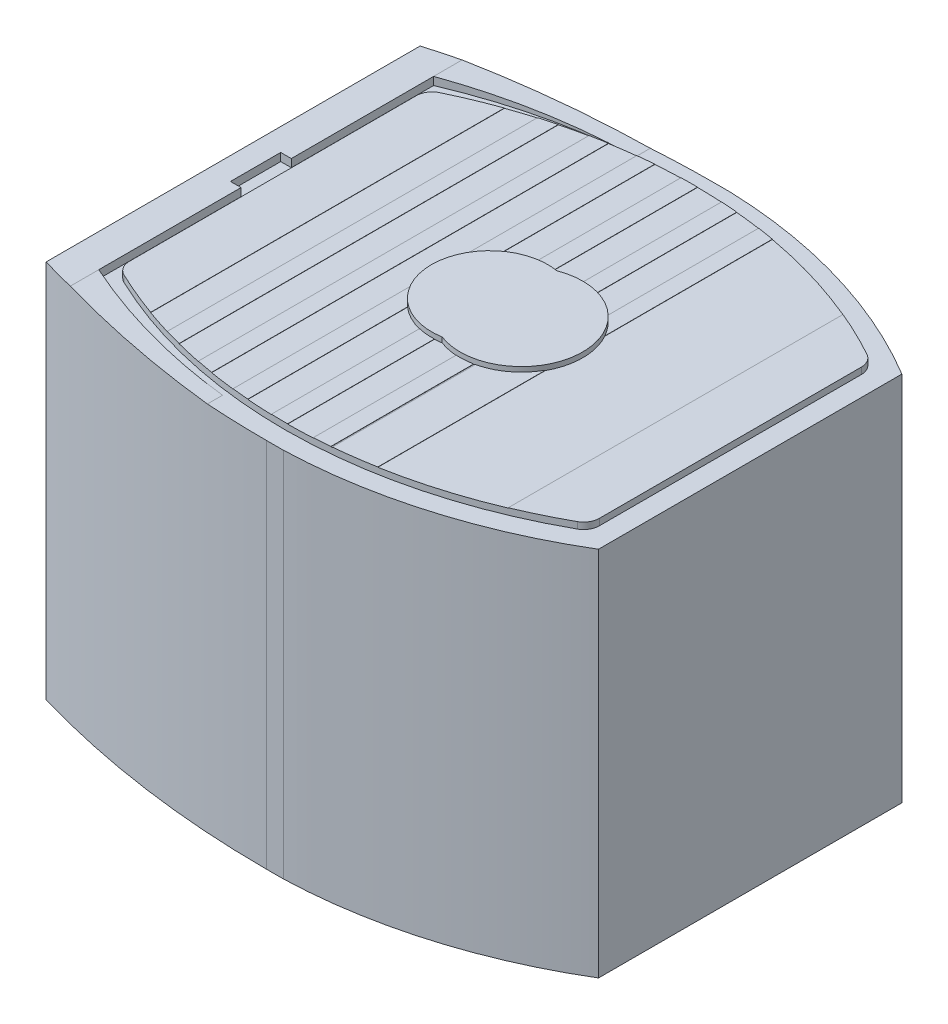
from build123d import *

# Parameters (mm, degrees)
BOSS_EXTRUDE1_DEPTH      = 40
CUT_EXTRUDE1_DEPTH       = 40
CUT_EXTRUDE1_DEPTH_BACK  = 40
CUT_EXTRUDE2_DEPTH       = 40
BOSS_EXTRUDE2_DEPTH      = 0.6223
CUT_EXTRUDE3_DEPTH       = 0.0254
CUT_EXTRUDE4_DEPTH       = 2.032
BOSS_EXTRUDE3_DEPTH      = 0.464
BOSS_EXTRUDE3_DEPTH_BACK = 0.464


with BuildPart() as part:
    # Sketch1 → Boss-Extrude1 (new body)
    with BuildSketch(Plane(origin=(0, -30.021892368, 0), x_dir=(-1, 0, 0), z_dir=(0, -1, 0))):
        with BuildLine():
            Line((-83.1596, 21.651358884), (-84.762120236, 21.651358884))
            ThreePointArc((-84.762120236, 21.651358884), (-96.885117924, 19.694671586), (-108.1278, 14.755258884))
            Line((-108.1278, 14.755258884), (-108.1278, -14.378541116))
            ThreePointArc((-108.1278, -14.378541116), (-96.885117924, -19.317953818), (-84.762120236, -21.274641116))
            Line((-84.762120236, -21.274641116), (-83.1596, -21.274641116))
            ThreePointArc((-83.1596, -21.274641116), (-70.690971885, -20.397039146), (-58.4708, -17.769441116))
            Line((-58.4708, -17.769441116), (-58.4708, 18.146158884))
            ThreePointArc((-58.4708, 18.146158884), (-70.690971885, 20.773756915), (-83.1596, 21.651358884))
        make_face()
    extrude(amount=-BOSS_EXTRUDE1_DEPTH)

    # Sketch2 → Cut-Extrude1 (cut, two sides: drawn at the far end of the back side and taken through both)
    with BuildSketch(Plane.XY.offset(-CUT_EXTRUDE1_DEPTH_BACK)):
        Polygon((54.820843696, 15.118469848), (54.820843696, 6.401707632), (61.6458, 6.401707632), (77.2668, 5.639707632), (110.448229866, 5.639707632), (110.448229866, 15.118469848), align=None)
    extrude(amount=CUT_EXTRUDE1_DEPTH + CUT_EXTRUDE1_DEPTH_BACK, mode=Mode.SUBTRACT)

    # Sketch3 → Cut-Extrude2 (cut)
    with BuildSketch(Plane(origin=(0, 5.639707632, 0), x_dir=(1, 0, 0), z_dir=(0, 1, 0))):
        with BuildLine():
            Line((60.6298, -2.224641116), (61.6458, -2.224641116))
            Line((61.6458, -2.224641116), (61.6458, -15.889841116))
            ThreePointArc((61.6458, -15.889841116), (69.299882493, -18.411140892), (77.2668, -19.623641116))
            Line((77.2668, -19.623641116), (77.2668, -24.484863345))
            Line((77.2668, -24.484863345), (116.145527093, -24.484863345))
            Line((116.145527093, -24.484863345), (116.145527093, 24.141945465))
            Line((116.145527093, 24.141945465), (77.2668, 24.141945465))
            Line((77.2668, 24.141945465), (77.2668, 20.000358884))
            ThreePointArc((77.2668, 20.000358884), (69.299882493, 18.78785866), (61.6458, 16.266558884))
            Line((61.6458, 16.266558884), (61.6458, 2.601358884))
            Line((61.6458, 2.601358884), (60.6298, 2.601358884))
            Line((60.6298, 2.601358884), (60.6298, -2.224641116))
        make_face()
    extrude(amount=CUT_EXTRUDE2_DEPTH, mode=Mode.SUBTRACT)

    # Sketch4 → Boss-Extrude2 (add)
    with BuildSketch(Plane(origin=(0, 5.639707632, 0), x_dir=(1, 0, 0), z_dir=(0, 1, 0))):
        with BuildLine():
            Line((62.2808, 13.97160372), (62.2808, -13.595028424))
            ThreePointArc((62.2808, -13.595028424), (62.515232291, -14.407180579), (63.146405148, -14.969470936))
            ThreePointArc((63.146405148, -14.969470936), (84.443626018, -19.477271857), (105.437261458, -13.718873038))
            ThreePointArc((105.437261458, -13.718873038), (106.011810141, -13.159417141), (106.2228, -12.385737382))
            Line((106.2228, -12.385737382), (106.2228, 12.76231749))
            ThreePointArc((106.2228, 12.76231749), (106.011758355, 13.536085129), (105.437082995, 14.095551986))
            ThreePointArc((105.437082995, 14.095551986), (84.443582525, 19.852401671), (63.146588971, 15.346134273))
            ThreePointArc((63.146588971, 15.346134273), (62.515286602, 14.783842106), (62.2808, 13.97160372))
        make_face()
    extrude(amount=BOSS_EXTRUDE2_DEPTH)

    # Sketch5 → Cut-Extrude3 (cut)
    with BuildSketch(Plane(origin=(0, 6.236607632, 0), x_dir=(1, 0, 0), z_dir=(0, 1, 0))):
        Polygon((60.8798, -1.974641116), (61.8958, -1.974641116), (61.8958, -15.724128062), (70.725222183, -18.261597014), (77.5168, -19.389388124), (77.5168, -26.279232644), (112.598613265, -26.279232644), (112.598613265, 26.642797699), (77.5168, 26.642797699), (77.5168, 19.766105893), (68.79799987, 18.208824767), (61.8958, 16.100845831), (61.8958, 2.351358884), (60.8798, 2.351358884), align=None)
        with BuildLine():
            Line((106.2228, -12.385737382), (106.2228, 12.76231749))
            ThreePointArc((106.2228, 12.76231749), (106.011758355, 13.536085129), (105.437082995, 14.095551986))
            ThreePointArc((105.437082995, 14.095551986), (103.230284294, 15.241015763), (100.965, 16.26597178))
            Line((100.965, 16.26597178), (100.965, -15.890015871))
            ThreePointArc((100.965, -15.890015871), (103.230393421, -14.864721653), (105.437261458, -13.718873038))
            ThreePointArc((105.437261458, -13.718873038), (106.011810141, -13.159417141), (106.2228, -12.385737382))
        make_face(mode=Mode.SUBTRACT)
        with BuildLine():
            Line((87.4776, -5.556736292), (87.4776, -19.287368321))
            ThreePointArc((87.4776, -19.287368321), (89.400866501, -19.062397708), (91.313, -18.756928734))
            Line((91.313, -18.756928734), (91.313, 19.132183186))
            ThreePointArc((91.313, 19.132183186), (90.526712944, 19.267736149), (89.7382, 19.389675799))
            Line((89.7382, 19.389675799), (89.7382, 4.870687927))
            Line((89.7382, 4.870687927), (87.4776, -5.556736292))
        make_face(mode=Mode.SUBTRACT)
        with BuildLine():
            Line((87.3506, -19.299351408), (87.3506, 19.674500659))
            ThreePointArc((87.3506, 19.674500659), (86.56371005, 19.740853373), (85.7758, 19.79373275))
            Line((85.7758, 19.79373275), (85.7758, -19.418600488))
            ThreePointArc((85.7758, -19.418600488), (86.563710251, -19.365714311), (87.3506, -19.299351408))
        make_face(mode=Mode.SUBTRACT)
        with BuildLine():
            Line((83.3882, -19.496401918), (83.3882, 19.871534346))
            ThreePointArc((83.3882, 19.871534346), (82.60073032, 19.870084861), (81.8134, 19.855199773))
            Line((81.8134, 19.855199773), (81.8134, -19.480050269))
            ThreePointArc((81.8134, -19.480050269), (82.600730229, -19.49494558), (83.3882, -19.496401918))
        make_face(mode=Mode.SUBTRACT)
        with BuildLine():
            Line((79.4258, -19.352519351), (79.4258, 19.727720695))
            ThreePointArc((79.4258, 19.727720695), (78.637747467, 19.658336413), (77.851, 19.575454588))
            Line((77.851, 19.575454588), (77.851, -19.200201536))
            ThreePointArc((77.851, -19.200201536), (78.63774708, -19.283110929), (79.4258, -19.352519351))
        make_face(mode=Mode.SUBTRACT)
        with BuildLine():
            Line((73.8886, 18.948166135), (73.8886, -18.57271762))
            ThreePointArc((73.8886, -18.57271762), (74.674734009, -18.725427281), (75.4634, -18.864469988))
            Line((75.4634, -18.864469988), (75.4634, 19.239829185))
            ThreePointArc((75.4634, 19.239829185), (74.674734726, 19.100829354), (73.8886, 18.948166135))
        make_face(mode=Mode.SUBTRACT)
        with BuildLine():
            Line((69.9262, 17.958552472), (69.9262, -17.58280399))
            ThreePointArc((69.9262, -17.58280399), (70.711659458, -17.808862859), (71.501, -18.020972927))
            Line((71.501, -18.020972927), (71.501, 18.396588518))
            ThreePointArc((71.501, 18.396588518), (70.711660575, 18.184542996), (69.9262, 17.958552472))
        make_face(mode=Mode.SUBTRACT)
        with BuildLine():
            Line((67.5386, -16.801329329), (67.5386, 17.177317791))
            ThreePointArc((67.5386, 17.177317791), (65.318978341, 16.31836829), (63.146588971, 15.346134273))
            ThreePointArc((63.146588971, 15.346134273), (62.515286602, 14.783842106), (62.2808, 13.97160372))
            Line((62.2808, 13.97160372), (62.2808, -13.595028424))
            ThreePointArc((62.2808, -13.595028424), (62.515232309, -14.407180609), (63.146405211, -14.969470967))
            ThreePointArc((63.146405211, -14.969470967), (65.318869691, -15.942064117), (67.5386, -16.801329329))
        make_face(mode=Mode.SUBTRACT)
    extrude(amount=CUT_EXTRUDE3_DEPTH, mode=Mode.SUBTRACT)

    # Sketch6 → Cut-Extrude4 (cut)
    with BuildSketch(Plane(origin=(0, -30.021892368, 0), x_dir=(-1, 0, 0), z_dir=(0, -1, 0))):
        with BuildLine():
            Line((-103.354005387, 3.220690187), (-102.196585301, 2.30003668))
            Line((-102.196585301, 2.30003668), (-103.552849915, 1.710316042))
            Line((-103.552849915, 1.710316042), (-102.319593922, 0.894041707))
            Line((-102.319593922, 0.894041707), (-103.6193, 0.188358884))
            Line((-103.6193, 0.188358884), (-102.319593922, -0.517323938))
            Line((-102.319593922, -0.517323938), (-103.552849915, -1.333598274))
            Line((-103.552849915, -1.333598274), (-102.196585301, -1.923318911))
            Line((-102.196585301, -1.923318911), (-103.354005387, -2.843972418))
            ThreePointArc((-103.354005387, -2.843972418), (-68.6943, 0.188358884), (-103.354005387, 3.220690187))
        make_face()
    extrude(amount=-CUT_EXTRUDE4_DEPTH, mode=Mode.SUBTRACT)

    # Sketch7 → Boss-Extrude3 (add, two sides: drawn at the far end of the back side and taken through both)
    with BuildSketch(Plane(origin=(0, 6.262007632, 0), x_dir=(1, 0, 0), z_dir=(0, 1, 0)).offset(-BOSS_EXTRUDE3_DEPTH_BACK)):
        with BuildLine():
            ThreePointArc((84.054570469, -5.319023636), (92.051766601, 0.188358884), (84.054570469, 5.695741404))
            ThreePointArc((84.054570469, 5.695741404), (77.5208, 0.188358884), (84.054570469, -5.319023636))
        make_face()
    extrude(amount=BOSS_EXTRUDE3_DEPTH + BOSS_EXTRUDE3_DEPTH_BACK)


solid = part.part
